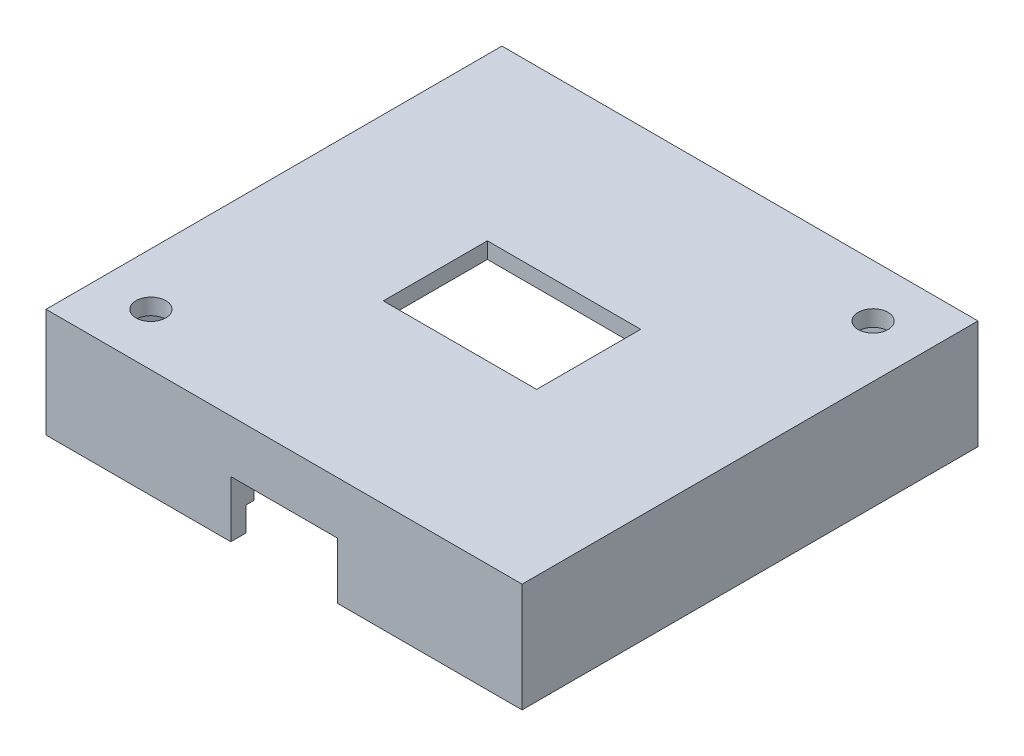
from build123d import *

# Parameters (mm, degrees)
SKETCH1_W           = 59
SKETCH1_H           = 56.5
BOSS_EXTRUDE1_DEPTH = 13.5
SKETCH2_W           = 55.2
SKETCH2_H           = 52.7
CUT_EXTRUDE1_DEPTH  = 11.5
SKETCH10_W          = 19
SKETCH10_H          = 12.9
CUT_EXTRUDE4_DEPTH  = 10
SKETCH11_W          = 6.1
SKETCH11_H          = 2.5
CUT_EXTRUDE5_DEPTH  = 10
SKETCH12_W          = 12.5
SKETCH12_H          = 11.5
CUT_EXTRUDE6_DEPTH  = 10
SKETCH13_W          = 13.2
SKETCH13_H          = 7
CUT_EXTRUDE7_DEPTH  = 10
BOSS_EXTRUDE2_DEPTH = 8.5
SKETCH16_R          = 1.8526
CUT_EXTRUDE8_DEPTH  = 3


with BuildPart() as part:
    # Sketch1 → Boss-Extrude1 (new body)
    with BuildSketch(Plane(origin=(0, 0, 0), x_dir=(1, 0, 0), z_dir=(0, 1, 0))):
        Rectangle(SKETCH1_W, SKETCH1_H)
    extrude(amount=BOSS_EXTRUDE1_DEPTH)

    # Sketch2 → Cut-Extrude1 (cut)
    with BuildSketch(Plane.XZ):
        Rectangle(SKETCH2_W, SKETCH2_H)
    extrude(amount=-CUT_EXTRUDE1_DEPTH, mode=Mode.SUBTRACT)

    # Sketch10 → Cut-Extrude4 (cut)
    with BuildSketch(Plane(origin=(0, 13.5, 0), x_dir=(1, 0, 0), z_dir=(0, 1, 0))):
        Rectangle(SKETCH10_W, SKETCH10_H)
    extrude(amount=-CUT_EXTRUDE4_DEPTH, mode=Mode.SUBTRACT)

    # Sketch11 → Cut-Extrude5 (cut)
    with BuildSketch(Plane.ZY.offset(29.5)):
        with Locations((0, 1.25)):
            Rectangle(SKETCH11_W, SKETCH11_H)
    extrude(amount=-CUT_EXTRUDE5_DEPTH, mode=Mode.SUBTRACT)

    # Sketch12 → Cut-Extrude6 (cut)
    with BuildSketch(Plane(origin=(0, 0, -28.25), x_dir=(-1, 0, 0), z_dir=(0, 0, -1))):
        with Locations((0, 5.75)):
            Rectangle(SKETCH12_W, SKETCH12_H)
    extrude(amount=-CUT_EXTRUDE6_DEPTH, mode=Mode.SUBTRACT)

    # Sketch13 → Cut-Extrude7 (cut)
    with BuildSketch(Plane.XY.offset(28.25)):
        with Locations((0, 3.5)):
            Rectangle(SKETCH13_W, SKETCH13_H)
    extrude(amount=-CUT_EXTRUDE7_DEPTH, mode=Mode.SUBTRACT)

    # Sketch14 → Boss-Extrude2 (add)
    with BuildSketch(Plane.XZ.offset(-11.5)):
        Polygon((-26.6, 25.35), (-26.6, 3.05), (-27.6, 3.05), (-27.6, 26.35), (-6.6, 26.35), (-6.6, 25.35), align=None)
        Polygon((-27.6, -26.35), (-6.25, -26.35), (-6.25, -25.35), (-26.6, -25.35), (-26.6, -3.05), (-27.6, -3.05), align=None)
        Polygon((27.6, 26.35), (27.6, -26.35), (6.25, -26.35), (6.25, -25.35), (26.6, -25.35), (26.6, 25.35), (6.6, 25.35), (6.6, 26.35), align=None)
    extrude(amount=BOSS_EXTRUDE2_DEPTH)

    # Sketch16 → Cut-Extrude8 (cut)
    with BuildSketch(Plane(origin=(0, 13.5, 0), x_dir=(1, 0, 0), z_dir=(0, 1, 0))):
        with Locations(Location((23, 21.75, 0), (0, 0, 90))):
            Circle(SKETCH16_R)
        with Locations(Location((-23, -21.75, 0), (0, 0, 90))):
            Circle(SKETCH16_R)
    extrude(amount=-CUT_EXTRUDE8_DEPTH, mode=Mode.SUBTRACT)


solid = part.part
